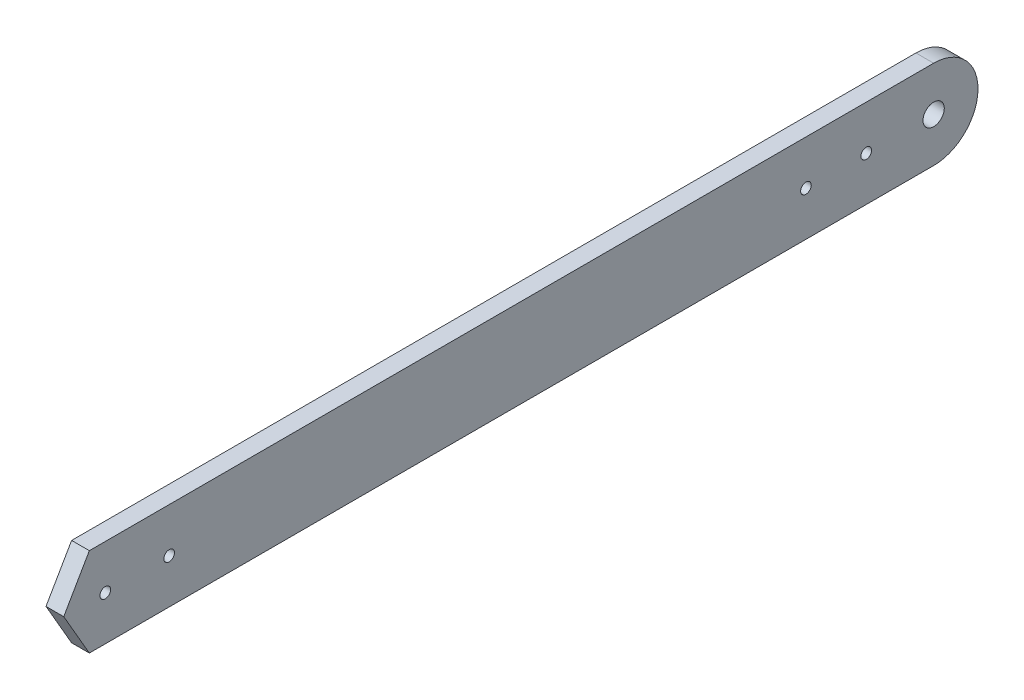
from build123d import *

# Parameters (mm, degrees)
SKETCH1_W           = 5
SKETCH1_H           = 25
BOSS_EXTRUDE1_DEPTH = 258.5
SKETCH2_R           = 3
SKETCH2_R_2         = 1.5
CUT_EXTRUDE1_DEPTH  = 259.850342862


with BuildPart() as part:
    # Sketch1 → Boss-Extrude1 (new body)
    with BuildSketch(Plane.XY):
        Rectangle(SKETCH1_W, SKETCH1_H)
    extrude(amount=BOSS_EXTRUDE1_DEPTH)

    # Sketch2 → Cut-Extrude1 (cut, through all)
    with BuildSketch(Plane(origin=(2.5, 0, 0), x_dir=(0, 0, -1), z_dir=(1, 0, 0))):
        with Locations((-12.5, 0)):
            Circle(SKETCH2_R)
        with Locations((-246, 0)):
            Circle(SKETCH2_R_2)
        with Locations((-228, 0)):
            Circle(SKETCH2_R_2)
        with Locations((-48.5, 0)):
            Circle(SKETCH2_R_2)
        with Locations((-31.5, 0)):
            Circle(SKETCH2_R_2)
        with BuildLine():
            Line((-12.5, 12.5), (5.5, 12.5))
            Line((5.5, 12.5), (5.5, -12.5))
            Line((5.5, -12.5), (-12.5, -12.5))
            ThreePointArc((-12.5, -12.5), (0, 0), (-12.5, 12.5))
        make_face()
        Polygon((-257.716878365, 0), (-250.5, 12.5), (-258.5, 12.5), (-258.5, -12.5), (-250.5, -12.5), align=None)
    extrude(amount=-CUT_EXTRUDE1_DEPTH, mode=Mode.SUBTRACT)


solid = part.part
